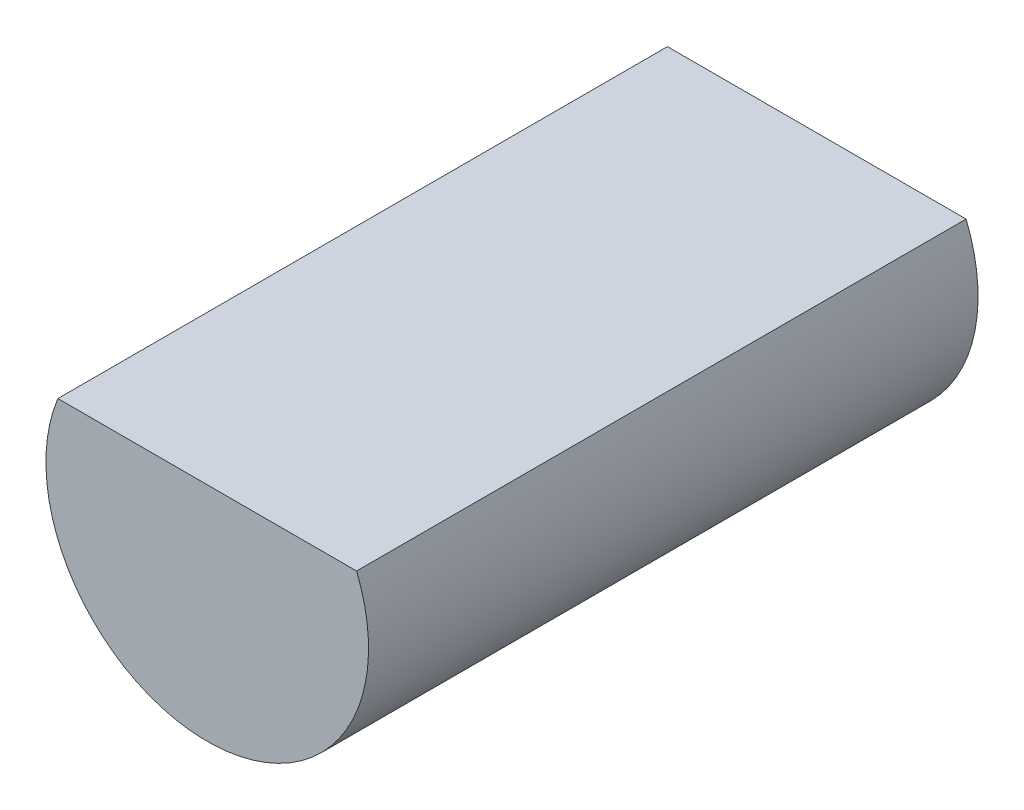
from build123d import *

# Parameters (mm, degrees)
EXTRUDE_1_DEPTH = 20


with BuildPart() as part:
    # 草图1 → 凸台-拉伸1 (new body)
    with BuildSketch(Plane.XY):
        with BuildLine():
            Line((4.9, 2), (-4.9, 2))
            ThreePointArc((-4.9, 2), (0, -5.292447449), (4.9, 2))
        make_face()
    extrude(amount=EXTRUDE_1_DEPTH)


solid = part.part
